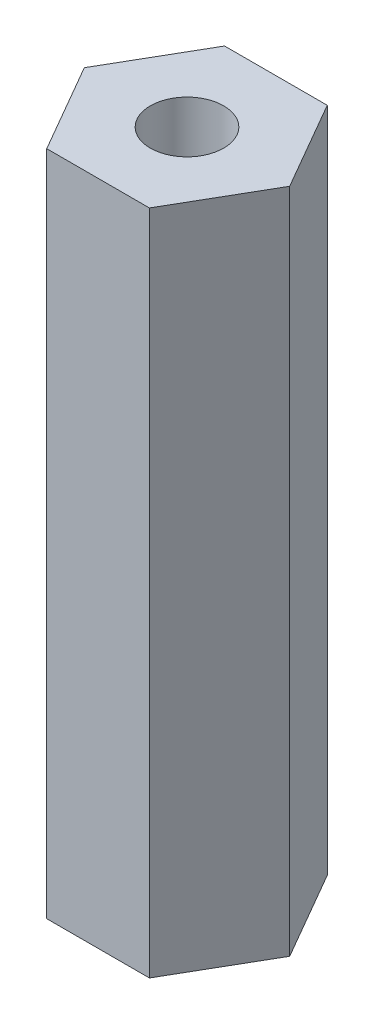
from build123d import *

# Parameters (mm, degrees)
CROQUIS1_R              = 1.65
SALIENTE_EXTRUIR1_DEPTH = 15


with BuildPart() as part:
    # Croquis1 → Saliente-Extruir1 (new, symmetric)
    with BuildSketch(Plane(origin=(0, 0, 0), x_dir=(1, 0, 0), z_dir=(0, 1, 0))):
        Polygon((-2.309401077, -4), (2.309401077, -4), (4.618802154, 0), (2.309401077, 4), (-2.309401077, 4), (-4.618802154, 0), align=None)
        with Locations(Location((0, 0, 0), (0, 0, 270))):
            Circle(CROQUIS1_R, mode=Mode.SUBTRACT)
    extrude(amount=SALIENTE_EXTRUIR1_DEPTH, both=True)


solid = part.part
